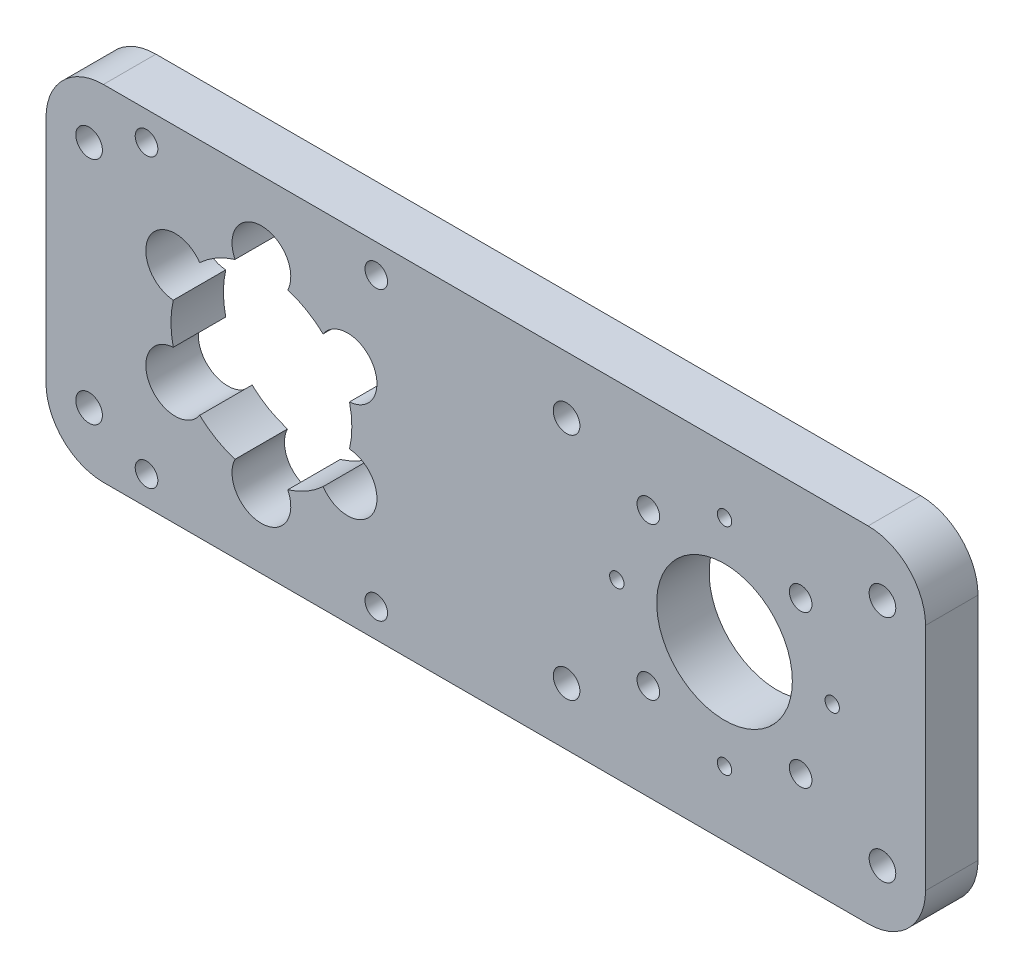
from build123d import *

# Parameters (mm, degrees)
SKETCH1_W                      = 97.2375
SKETCH1_H                      = 38.1
SKETCH1_R                      = 7.5
SKETCH1_R_2                    = 10
BOSS_EXTRUDE1_DEPTH            = 5.8
CBORE_FOR_M3_SHCS1_D           = 3.2
CBORE_FOR_M3_SHCS1_CBORE_D     = 6.5
CBORE_FOR_M3_SHCS1_CBORE_DEPTH = 13
FILLET1_R                      = 6.35
F_4_CLEARANCE_HOLE1_D          = 2.9464
F_4_CLEARANCE_HOLE1_DEPTH      = 5.8
F_4_CLEARANCE_HOLE1_TIP        = 0.885187864
M3X0_5_TAPPED_HOLE1_D          = 2.5
M3X0_5_TAPPED_HOLE1_DEPTH      = 7.5
M3X0_5_TAPPED_HOLE1_TIP        = 0.751075774
M3X0_5_TAPPED_HOLE2_D          = 2.5
M3X0_5_TAPPED_HOLE2_DEPTH      = 8.5
M3X0_5_TAPPED_HOLE2_TIP        = 0.751075774
SKETCH17_R                     = 0.79375
CUT_EXTRUDE3_DEPTH             = 105.596278166


with BuildPart() as part:
    # Sketch1 → Boss-Extrude1 (new body)
    with BuildSketch(Plane.XY):
        with Locations((48.61875, 19.05)):
            Rectangle(SKETCH1_W, SKETCH1_H)
        with Locations((75.0125, 19.05)):
            Circle(SKETCH1_R, mode=Mode.SUBTRACT)
        with Locations((23.8125, 19.05)):
            Circle(SKETCH1_R_2, mode=Mode.SUBTRACT)
    extrude(amount=BOSS_EXTRUDE1_DEPTH)

    # CBORE for M3 SHCS1 (through all)
    with Locations(Plane.XY.offset(5.8)):
        with Locations((33.338779442, 13.55), (33.338779442, 24.55), (23.8125, 30.05), (14.286220558, 24.55), (14.286220558, 13.55), (23.8125, 8.05)):
            CounterBoreHole(CBORE_FOR_M3_SHCS1_D / 2, CBORE_FOR_M3_SHCS1_CBORE_D / 2, CBORE_FOR_M3_SHCS1_CBORE_DEPTH)

    # Fillet1
    fillet1_edges = [part.edges().sort_by_distance(p)[0] for p in [
        (0, 0, 2.9),
        (0, 38.1, 2.9),
        (97.2375, 38.1, 2.9),
        (97.2375, 0, 2.9),
    ]]
    fillet(fillet1_edges, radius=FILLET1_R)

    # #4 Clearance Hole1
    with Locations(Plane.XY.offset(5.8)):
        with Locations((4.7625, 31.75), (4.7625, 6.35), (92.475, 6.35), (92.475, 31.75), (57.55, 31.75), (57.55, 6.35)):
            Hole(F_4_CLEARANCE_HOLE1_D / 2, depth=F_4_CLEARANCE_HOLE1_DEPTH)
            with Locations((0, 0, -(F_4_CLEARANCE_HOLE1_DEPTH + F_4_CLEARANCE_HOLE1_TIP / 2))):  # 118° drill point
                Cone(0, F_4_CLEARANCE_HOLE1_D / 2, F_4_CLEARANCE_HOLE1_TIP, mode=Mode.SUBTRACT)

    # M3x0.5 Tapped Hole1
    with Locations(Plane.XY.offset(5.8)):
        with Locations((11.1125, 34.925), (36.5125, 34.925), (36.5125, 3.175), (11.1125, 3.175)):
            Hole(M3X0_5_TAPPED_HOLE1_D / 2, depth=M3X0_5_TAPPED_HOLE1_DEPTH)
            with Locations((0, 0, -(M3X0_5_TAPPED_HOLE1_DEPTH + M3X0_5_TAPPED_HOLE1_TIP / 2))):  # 118° drill point
                Cone(0, M3X0_5_TAPPED_HOLE1_D / 2, M3X0_5_TAPPED_HOLE1_TIP, mode=Mode.SUBTRACT)

    # M3x0.5 Tapped Hole2
    with Locations(Plane.XY.offset(5.8)):
        with Locations((66.593509886, 27.468990114), (83.431490114, 27.468990114), (83.431490114, 10.631009886), (66.593509886, 10.631009886)):
            Hole(M3X0_5_TAPPED_HOLE2_D / 2, depth=M3X0_5_TAPPED_HOLE2_DEPTH)
            with Locations((0, 0, -(M3X0_5_TAPPED_HOLE2_DEPTH + M3X0_5_TAPPED_HOLE2_TIP / 2))):  # 118° drill point
                Cone(0, M3X0_5_TAPPED_HOLE2_D / 2, M3X0_5_TAPPED_HOLE2_TIP, mode=Mode.SUBTRACT)

    # Sketch17 → Cut-Extrude3 (cut, through all)
    with BuildSketch(Plane.XY.offset(5.8)):
        with Locations((63.10625, 19.05)):
            Circle(SKETCH17_R)
        with Locations((75.0125, 7.14375)):
            Circle(SKETCH17_R)
        with Locations((86.91875, 19.05)):
            Circle(SKETCH17_R)
        with Locations((75.0125, 30.95625)):
            Circle(SKETCH17_R)
    extrude(amount=-CUT_EXTRUDE3_DEPTH, mode=Mode.SUBTRACT)


solid = part.part
